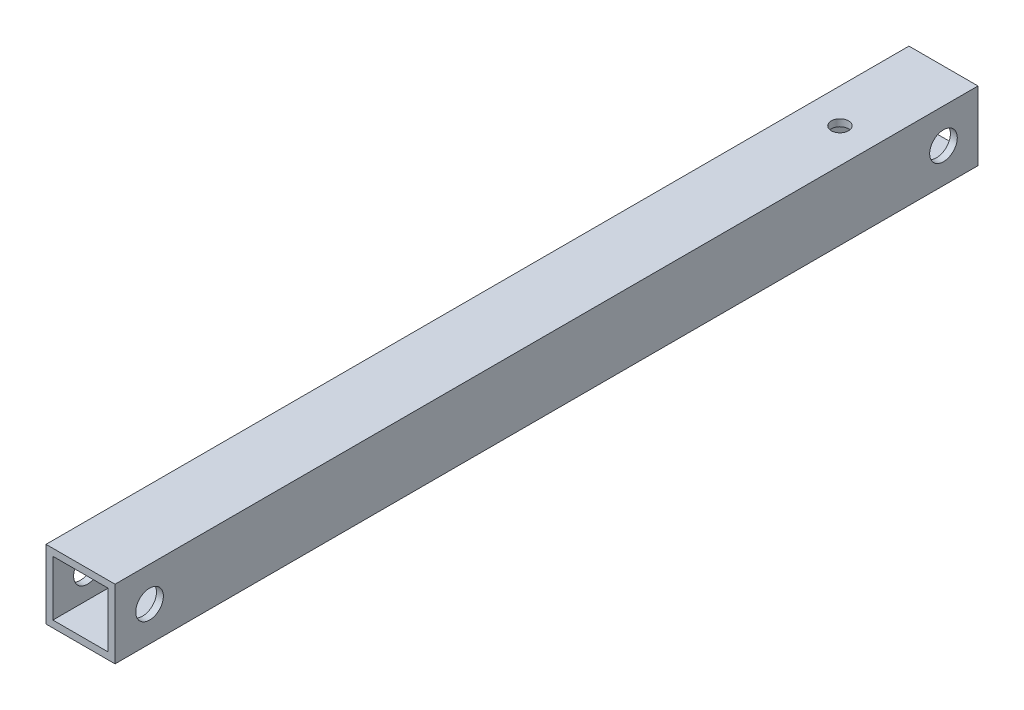
from build123d import *

# Parameters (mm, degrees)
SZKIC1_W                    = 20
SZKIC1_H                    = 20
SZKIC1_W_2                  = 16
SZKIC1_H_2                  = 16
DODANIE_WYCI_GNI_CIE1_DEPTH = 250
SZKIC2_R                    = 4
WYTNIJ_WYCI_GNI_CIE1_DEPTH  = 251.99800796
SZKIC3_R                    = 2.5
WYTNIJ_WYCI_GNI_CIE2_DEPTH  = 251.99800796


with BuildPart() as part:
    # Szkic1 → Dodanie-wyciągnięcie1 (new body)
    with BuildSketch(Plane.XY):
        Rectangle(SZKIC1_W, SZKIC1_H)
        Rectangle(SZKIC1_W_2, SZKIC1_H_2, mode=Mode.SUBTRACT)
    extrude(amount=DODANIE_WYCI_GNI_CIE1_DEPTH)

    # Szkic2 → Wytnij-wyciągnięcie1 (cut, through all)
    with BuildSketch(Plane(origin=(10, 0, 0), x_dir=(0, 0, -1), z_dir=(1, 0, 0))):
        with Locations((-10, 0)):
            Circle(SZKIC2_R)
        with Locations((-240, 0)):
            Circle(SZKIC2_R)
    extrude(amount=-WYTNIJ_WYCI_GNI_CIE1_DEPTH, mode=Mode.SUBTRACT)

    # Szkic3 → Wytnij-wyciągnięcie2 (cut, through all)
    with BuildSketch(Plane(origin=(0, 10, 0), x_dir=(1, 0, 0), z_dir=(0, 1, 0))):
        with Locations(Location((0, -30, 0), (0, 0, 270))):
            Circle(SZKIC3_R)
    extrude(amount=-WYTNIJ_WYCI_GNI_CIE2_DEPTH, mode=Mode.SUBTRACT)


solid = part.part
